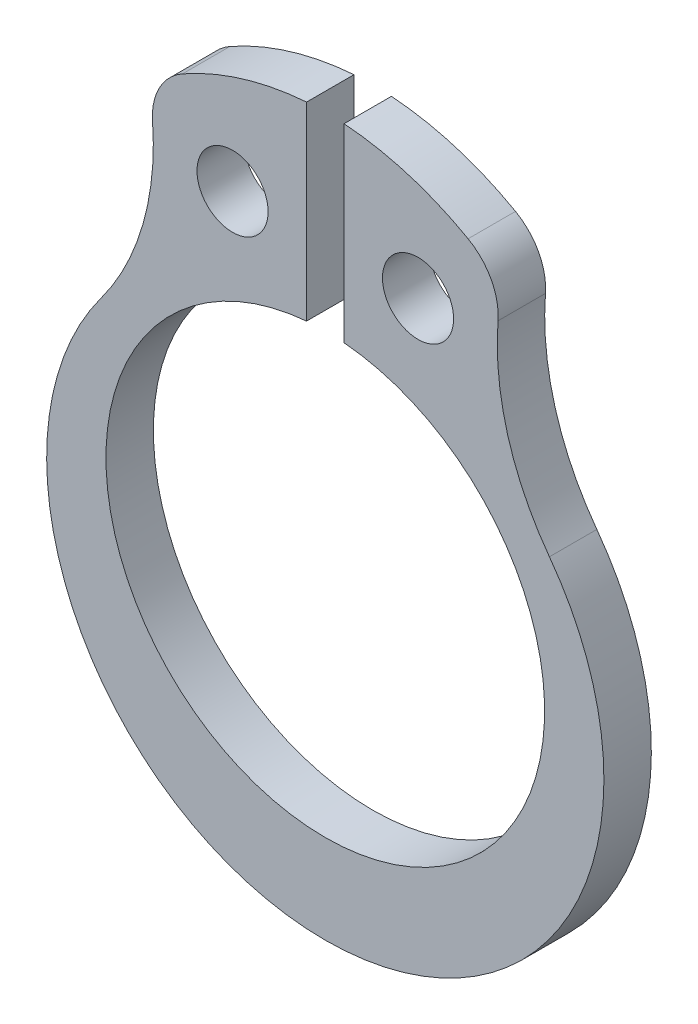
from build123d import *

# Parameters (mm, degrees)
SKETCH1_R           = 0.6
BOSS_EXTRUDE1_DEPTH = 0.4


with BuildPart() as part:
    # Sketch1 → Boss-Extrude1 (new, symmetric)
    with BuildSketch(Plane.XY):
        with BuildLine():
            Line((-0.316012901, 6.886480143), (-0.316012901, 3.686480143))
            ThreePointArc((-0.316012901, 3.686480143), (0, -3.7), (0.316012901, 3.686480143))
            Line((0.316012901, 3.686480143), (0.316012901, 6.886480143))
            ThreePointArc((0.316012901, 6.886480143), (1.397594622, 6.685090886), (2.408950376, 6.252036397))
            ThreePointArc((2.408950376, 6.252036397), (2.798867192, 5.852361563), (2.913708704, 5.305930851))
            ThreePointArc((2.913708704, 5.305930851), (3.07621584, 3.720980048), (3.780838239, 2.29199968))
            ThreePointArc((3.780838239, 2.29199968), (0, -5.2), (-3.780838239, 2.29199968))
            ThreePointArc((-3.780838239, 2.29199968), (-3.07621584, 3.720980048), (-2.913708704, 5.305930851))
            ThreePointArc((-2.913708704, 5.305930851), (-2.798867192, 5.852361563), (-2.408950376, 6.252036397))
            ThreePointArc((-2.408950376, 6.252036397), (-1.397594622, 6.685090886), (-0.316012901, 6.886480143))
        make_face()
        with Locations((-1.564690763, 4.959006233)):
            Circle(SKETCH1_R, mode=Mode.SUBTRACT)
        with Locations(Location((1.564690763, 4.959006233, 0), (0, 0, 180))):
            Circle(SKETCH1_R, mode=Mode.SUBTRACT)
    extrude(amount=BOSS_EXTRUDE1_DEPTH, both=True)


solid = part.part
